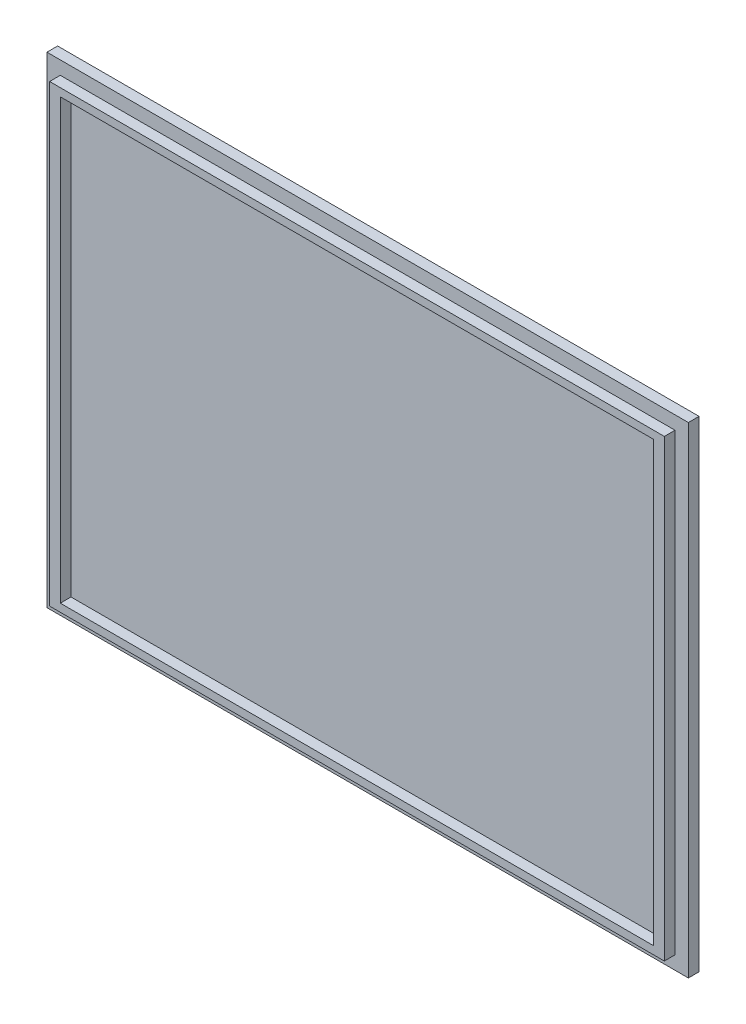
from build123d import *

# Parameters (mm, degrees)
ESQUISSE1_W        = 120
ESQUISSE1_H        = 90
BOSS_EXTRU_1_DEPTH = 2
ESQUISSE2_W        = 115
ESQUISSE2_H        = 85
ESQUISSE2_W_2      = 111
ESQUISSE2_H_2      = 82.04347826
BOSS_EXTRU_2_DEPTH = 2


with BuildPart() as part:
    # Esquisse1 → Boss.-Extru.1 (new body)
    with BuildSketch(Plane.XY):
        Rectangle(ESQUISSE1_W, ESQUISSE1_H)
    extrude(amount=BOSS_EXTRU_1_DEPTH)

    # Esquisse2 → Boss.-Extru.2 (add)
    with BuildSketch(Plane.XY.offset(2)):
        Rectangle(ESQUISSE2_W, ESQUISSE2_H)
        Rectangle(ESQUISSE2_W_2, ESQUISSE2_H_2, mode=Mode.SUBTRACT)
    extrude(amount=BOSS_EXTRU_2_DEPTH)


solid = part.part
